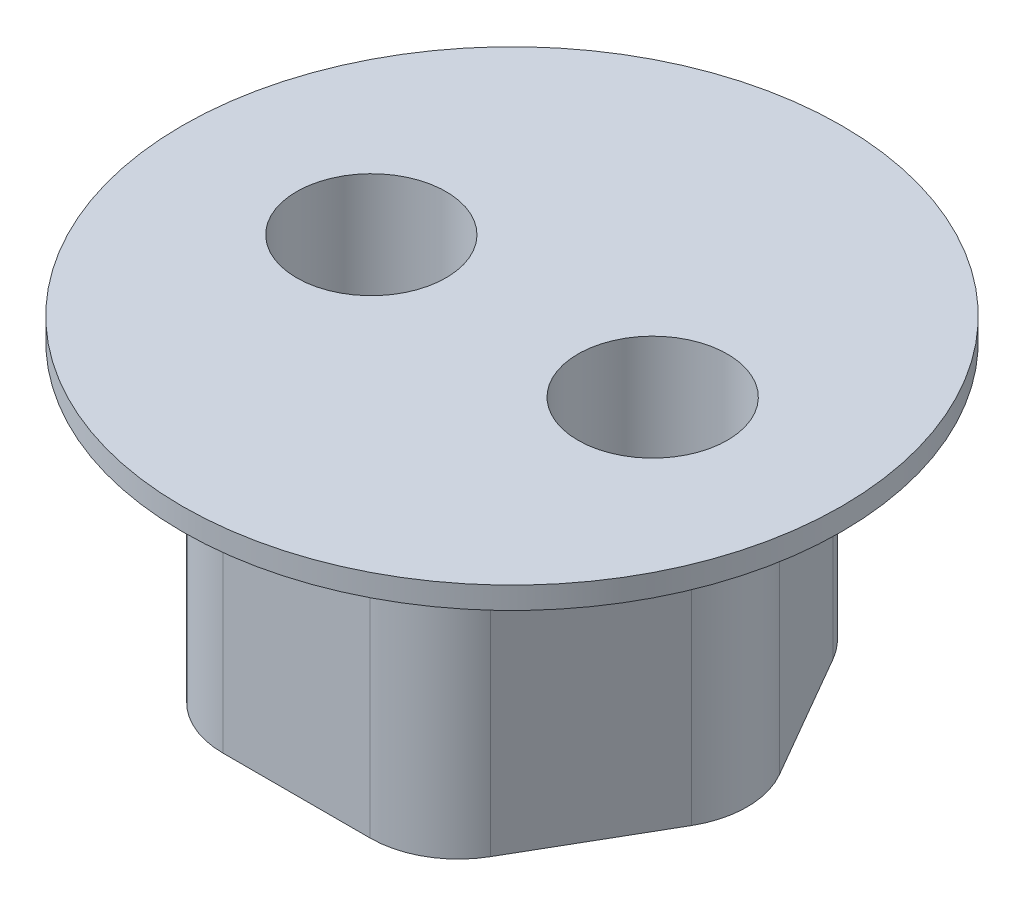
from build123d import *

# Parameters (mm, degrees)
BOSS_EXTRUDE1_DEPTH     = 8.255
SKETCH2_R               = 9.525
BOSS_EXTRUDE2_DEPTH     = 0.635
CUT_EXTRUDE1_DEPTH      = 17.139496584
CUT_EXTRUDE1_DEPTH_BACK = 17.139496584
SKETCH3_R               = 2.159
FILLET1_R               = 2.54


with BuildPart() as part:
    # Sketch1 → Boss-Extrude1 (new body)
    with BuildSketch(Plane(origin=(0, 0, 0), x_dir=(1, 0, 0), z_dir=(0, 1, 0))):
        Polygon((7.18570145, 0), (3.592850725, 6.223), (-3.592850725, 6.223), (-7.18570145, 0), (-3.592850725, -6.223), (3.592850725, -6.223), align=None)
    extrude(amount=BOSS_EXTRUDE1_DEPTH)

    # Sketch2 → Boss-Extrude2 (add)
    with BuildSketch(Plane(origin=(0, 8.255, 0), x_dir=(1, 0, 0), z_dir=(0, 1, 0))):
        with Locations(Location((0, 0, 0), (0, 0, 270))):
            Circle(SKETCH2_R)
    extrude(amount=BOSS_EXTRUDE2_DEPTH)

    # Sketch3 → Cut-Extrude1 (cut, two sides: drawn at the far end of the back side and taken through both)
    with BuildSketch(Plane(origin=(0, 8.89, 0), x_dir=(1, 0, 0), z_dir=(0, 1, 0)).offset(-CUT_EXTRUDE1_DEPTH_BACK)):
        with Locations(Location((-4.064, 0, 0), (0, 0, 270))):
            Circle(SKETCH3_R)
        with Locations(Location((4.064, 0, 0), (0, 0, 270))):
            Circle(SKETCH3_R)
    extrude(amount=CUT_EXTRUDE1_DEPTH + CUT_EXTRUDE1_DEPTH_BACK, mode=Mode.SUBTRACT)

    # Fillet1
    fillet1_edges = [part.edges().sort_by_distance(p)[0] for p in [
        (3.592850725, 4.1275, 6.223),
        (-3.592850725, 4.1275, 6.223),
        (-7.18570145, 4.1275, 0),
        (-3.592850725, 4.1275, -6.223),
        (3.592850725, 4.1275, -6.223),
        (7.18570145, 4.1275, 0),
    ]]
    fillet(fillet1_edges, radius=FILLET1_R)


solid = part.part
